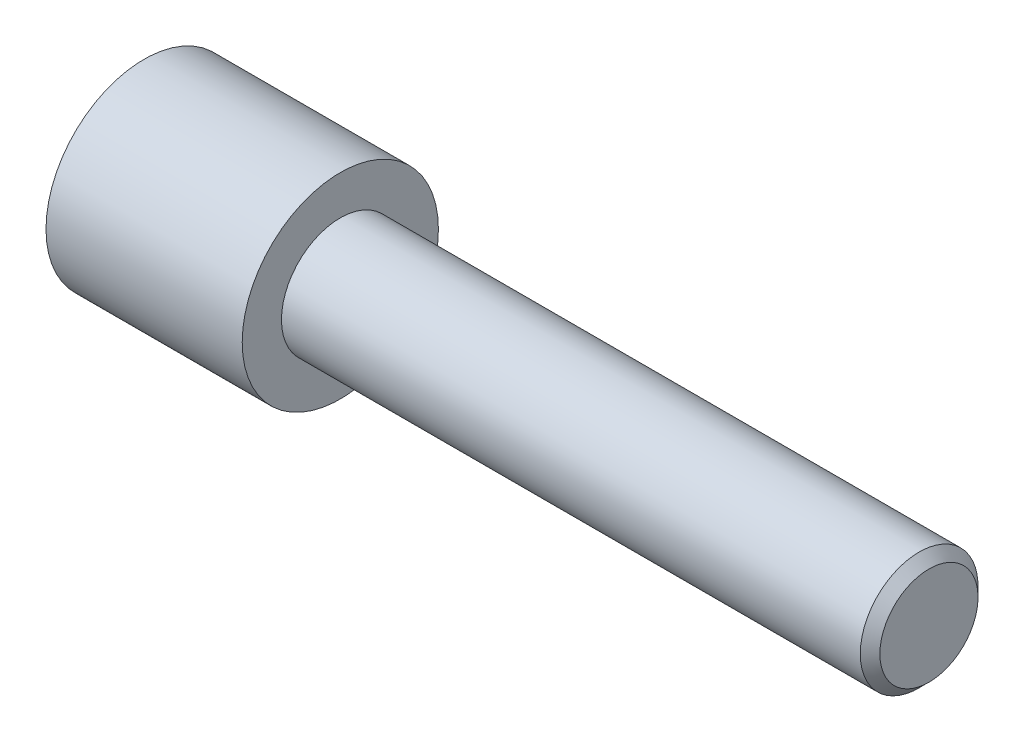
from build123d import *

# Parameters (mm, degrees)
SKETCH1_W     = 60
SKETCH1_H     = 6
CHAMFER1_SIZE = 1


with BuildPart() as part:
    # Sketch1 → Revolve1 (revolve)
    with BuildSketch(Plane.XY, mode=Mode.PRIVATE) as revolve1_sk:
        with Locations((30, 3)):
            Rectangle(SKETCH1_W, SKETCH1_H)
        Polygon((-20, 0), (0, 0), (0, 6), (0, 10), (-20, 10), align=None)
    revolve(revolve1_sk.sketch.rotate(Axis((0, 0, 0), (1, 0, 0)), 90), axis=Axis((0, 0, 0), (1, 0, 0)))

    # Chamfer1
    chamfer1_edges = [part.edges().sort_by_distance(p)[0] for p in [
        (60, 0, -6),
    ]]
    chamfer(chamfer1_edges, length=CHAMFER1_SIZE)


solid = part.part
